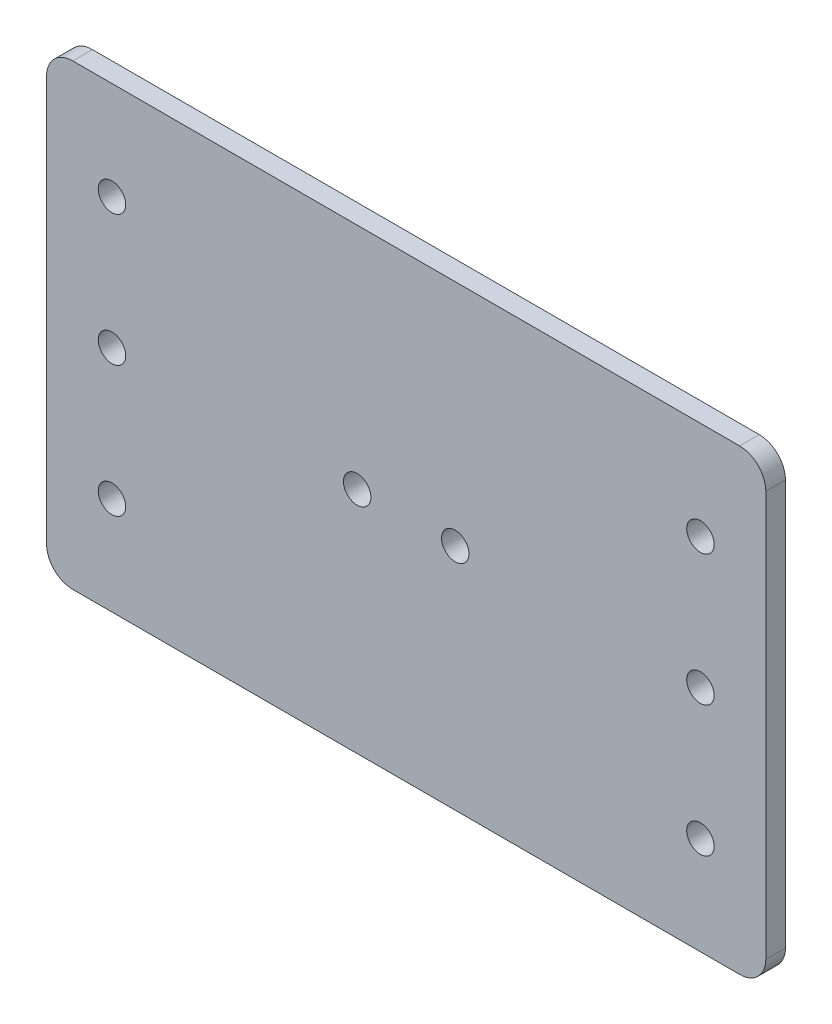
from build123d import *

# Parameters (mm, degrees)
SKETCH_1_W      = 110
SKETCH_1_H      = 70
SKETCH_1_R      = 2.1
EXTRUDE_1_DEPTH = 3
FILLET_1_R      = 4


with BuildPart() as part:
    # 草图1 → 凸台-拉伸1 (new body)
    with BuildSketch(Plane.XY):
        Rectangle(SKETCH_1_W, SKETCH_1_H)
        with Locations((45, 20)):
            Circle(SKETCH_1_R, mode=Mode.SUBTRACT)
        with Locations((45, 0)):
            Circle(SKETCH_1_R, mode=Mode.SUBTRACT)
        with Locations((45, -20)):
            Circle(SKETCH_1_R, mode=Mode.SUBTRACT)
        with Locations(Location((-45, 20, 0), (0, 0, 180))):
            Circle(SKETCH_1_R, mode=Mode.SUBTRACT)
        with Locations(Location((-45, 0, 0), (0, 0, 180))):
            Circle(SKETCH_1_R, mode=Mode.SUBTRACT)
        with Locations(Location((-45, -20, 0), (0, 0, 180))):
            Circle(SKETCH_1_R, mode=Mode.SUBTRACT)
        with Locations((-7.5, 0)):
            Circle(SKETCH_1_R, mode=Mode.SUBTRACT)
        with Locations(Location((7.5, 0, 0), (0, 0, 180))):
            Circle(SKETCH_1_R, mode=Mode.SUBTRACT)
    extrude(amount=EXTRUDE_1_DEPTH)

    # 圆角1
    fillet_1_edges = [part.edges().sort_by_distance(p)[0] for p in [
        (55, -35, 1.5),
        (-55, -35, 1.5),
        (-55, 35, 1.5),
        (55, 35, 1.5),
    ]]
    fillet(fillet_1_edges, radius=FILLET_1_R)


solid = part.part
